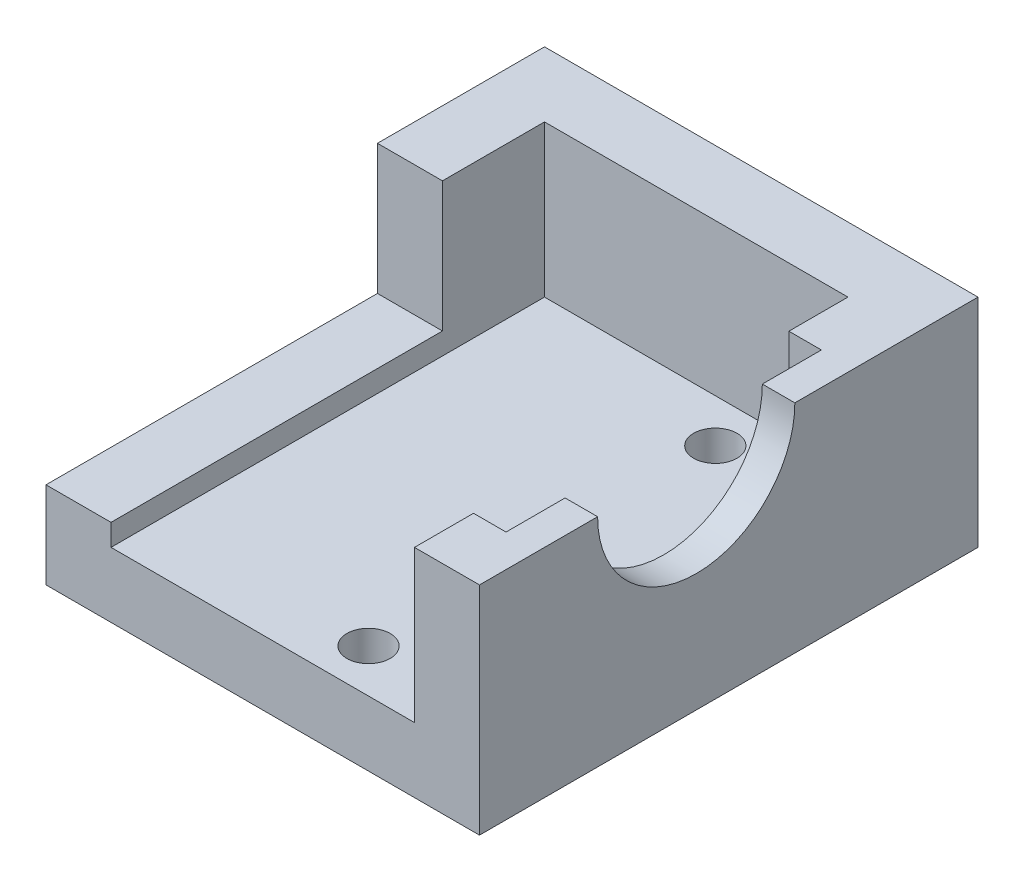
from build123d import *

# Parameters (mm, degrees)
SKETCH1_W           = 20
SKETCH1_H           = 23
BOSS_EXTRUDE1_DEPTH = 10
CUT_EXTRUDE1_DEPTH  = 7
SKETCH4_R           = 4.55
CUT_EXTRUDE6_DEPTH  = 7
SKETCH9_W           = 14.55
SKETCH9_H           = 7
CUT_EXTRUDE8_DEPTH  = 1.5
SKETCH10_W          = 15.291428019
SKETCH10_H          = 6
CUT_EXTRUDE9_DEPTH  = 5.5
SKETCH11_R          = 1
CUT_EXTRUDE10_DEPTH = 5.5


with BuildPart() as part:
    # Sketch1 → Boss-Extrude1 (new body)
    with BuildSketch(Plane(origin=(0, 0, 0), x_dir=(1, 0, 0), z_dir=(0, 1, 0))):
        Rectangle(SKETCH1_W, SKETCH1_H)
    extrude(amount=BOSS_EXTRUDE1_DEPTH)

    # Sketch3 → Cut-Extrude1 (cut)
    with BuildSketch(Plane(origin=(0, 10, 0), x_dir=(1, 0, 0), z_dir=(0, 1, 0))):
        Polygon((0, -11.5), (-7, -11.5), (-7, 8.5), (7, 8.5), (7, -11.5), align=None)
    extrude(amount=-CUT_EXTRUDE1_DEPTH, mode=Mode.SUBTRACT)

    # Sketch4 → Cut-Extrude6 (cut)
    with BuildSketch(Plane(origin=(10, 0, 0), x_dir=(0, 0, -1), z_dir=(1, 0, 0))):
        with Locations((-1.5, 10)):
            Circle(SKETCH4_R)
    extrude(amount=-CUT_EXTRUDE6_DEPTH, mode=Mode.SUBTRACT)

    # Sketch9 → Cut-Extrude8 (cut)
    with BuildSketch(Plane.ZY.offset(-7)):
        with Locations((1.5, 6.5)):
            Rectangle(SKETCH9_W, SKETCH9_H)
    extrude(amount=-CUT_EXTRUDE8_DEPTH, mode=Mode.SUBTRACT)

    # Sketch10 → Cut-Extrude9 (cut)
    with BuildSketch(Plane.ZY.offset(10)):
        with Locations((3.854285991, 7)):
            Rectangle(SKETCH10_W, SKETCH10_H)
    extrude(amount=-CUT_EXTRUDE9_DEPTH, mode=Mode.SUBTRACT)

    # Sketch11 → Cut-Extrude10 (cut)
    with BuildSketch(Plane.XZ):
        with Locations(Location((2.88, 9.5, 0), (0, 0, 270))):
            Circle(SKETCH11_R)
        with Locations(Location((2.88, -6.5, 0), (0, 0, 270))):
            Circle(SKETCH11_R)
    extrude(amount=-CUT_EXTRUDE10_DEPTH, mode=Mode.SUBTRACT)


solid = part.part
